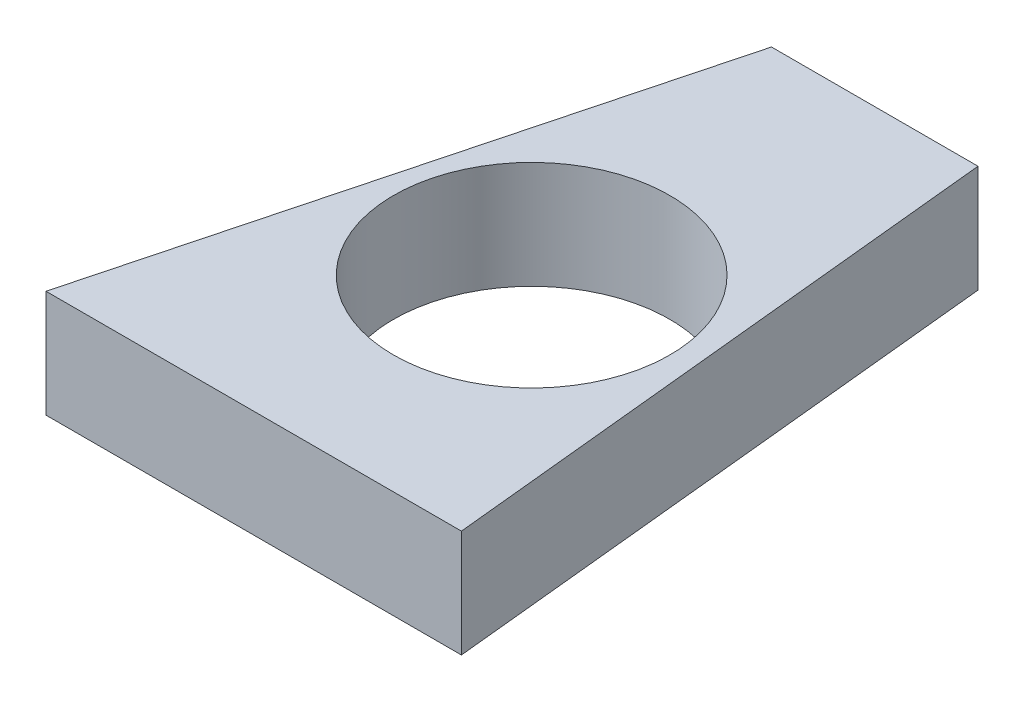
from build123d import *

# Parameters (mm, degrees)
SKETCH1_R           = 47
BOSS_EXTRUDE1_DEPTH = 36.5


with BuildPart() as part:
    # Sketch1 → Boss-Extrude1 (new body)
    with BuildSketch(Plane(origin=(0, 0, 0), x_dir=(1, 0, 0), z_dir=(0, 1, 0))):
        Polygon((43.803956609, 108.014745968), (-26.441962507, 108.014745968), (-77.870133755, -87.324564228), (63.433638897, -87.324564228), align=None)
        with Locations(Location((0, 0, 0), (0, 0, 270))):
            Circle(SKETCH1_R, mode=Mode.SUBTRACT)
    extrude(amount=BOSS_EXTRUDE1_DEPTH)


solid = part.part
